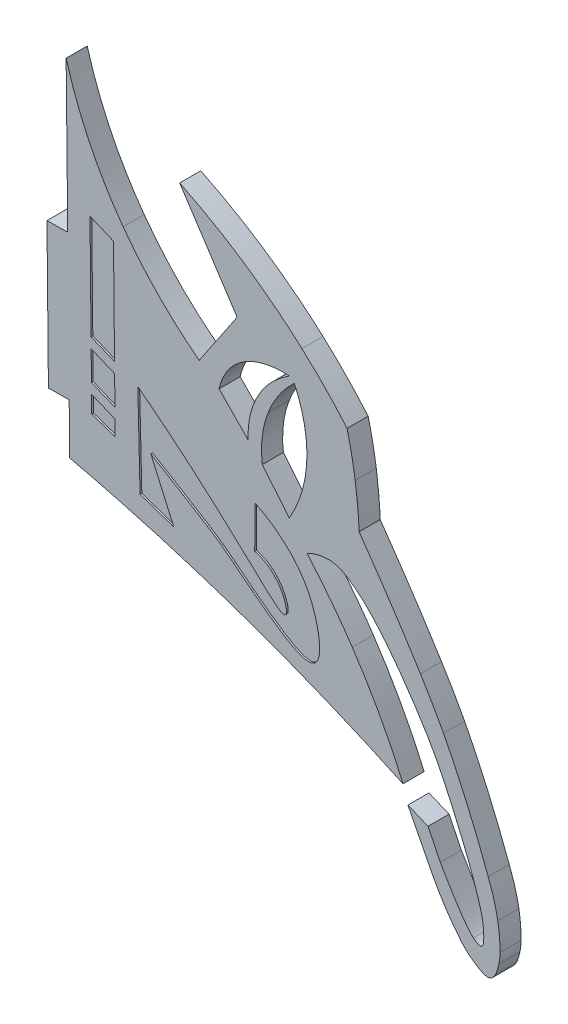
from build123d import *

# Parameters (mm, degrees)
BOSS_EXTRUDE1_DEPTH = 5.5
BOSS_EXTRUDE2_DEPTH = 6


with BuildPart() as part:
    # Model → Boss-Extrude1 (new body)
    with BuildSketch(Plane.XY):
        with BuildLine():
            add(Edge.make_bspline(
                [(109.834226, 17.744569), (106.735558, 23.743131), (104.335879, 28.467926), (102.940806, 31.225657)],
                knots=[0, 0, 0, 0, 1, 1, 1, 1], degree=3))
            ThreePointArc((109.834226, 17.744569), (113.743864145, 11.101212281), (118.360513621, 4.928206))
            add(Edge.make_bspline(
                [(121.463608, 2.155106), (119.789483664, 3.292442124), (118.727221514, 4.487161551), (118.360513621, 4.928206)],
                knots=[0, 0, 0, 0, 0.87061796, 0.87061796, 0.87061796, 0.87061796], degree=3))
            add(Edge.make_bspline(
                [(126.440333, 0.332713), (124.986288, -0.294061), (123.106948, 1.038656), (121.463608, 2.155106)],
                knots=[0, 0, 0, 0, 1, 1, 1, 1], degree=3))
            add(Edge.make_bspline(
                [(128.822962, 4.928206), (128.480309, 3.473676), (127.896944, 0.960588), (126.440333, 0.332713)],
                knots=[0, 0, 0, 0, 1, 1, 1, 1], degree=3))
            add(Edge.make_bspline(
                [(129.146717, 7.928679), (129.136257, 7.003388), (129.092662, 6.073042), (128.822962, 4.928206)],
                knots=[0, 0, 0, 0, 1, 1, 1, 1], degree=3))
            add(Edge.make_bspline(
                [(128.540698, 15.491307), (128.632815, 14.987485), (129.191051, 11.849306), (129.146717, 7.928679)],
                knots=[0, 0, 0, 0, 1, 1, 1, 1], degree=3))
            add(Edge.make_bspline(
                [(125.795153, 24.985524), (127.307626, 21.17734), (128.099604, 17.90388), (128.540698, 15.491307)],
                knots=[0, 0, 0, 0, 1, 1, 1, 1], degree=3))
            add(Edge.make_bspline(
                [(113.080832, 54.003331), (113.080842, 54.00332), (119.415646, 42.219052), (125.795153, 24.985524)],
                knots=[0, 0, 0, 0, 1, 1, 1, 1], degree=3))
            add(Edge.make_bspline(
                [(106.506681, 65.381827), (108.74943, 61.750912), (110.648644, 58.527792), (113.080832, 54.003331)],
                knots=[0, 0, 0, 0, 1, 1, 1, 1], degree=3))
            add(Edge.make_bspline(
                [(89.049511, 91.666149), (92.441385, 86.830647), (99.914814, 76.053776), (106.506681, 65.381827)],
                knots=[0, 0, 0, 0, 1, 1, 1, 1], degree=3))
            add(Edge.make_bspline(
                [(87.934382, 103.740468), (88.56126, 99.412169), (88.900341, 95.366482), (89.049511, 91.666149)],
                knots=[0, 0, 0, 0, 1, 1, 1, 1], degree=3))
            add(Edge.make_bspline(
                [(85.630465, 115.43659), (86.516891, 111.891294), (87.320202, 107.981033), (87.934382, 103.740468)],
                knots=[0, 0, 0, 0, 1, 1, 1, 1], degree=3))
            add(Edge.make_bspline(
                [(72.776561, 128.674577), (77.74838, 124.17885), (82.002138, 119.69877), (85.630465, 115.43659)],
                knots=[0, 0, 0, 0, 1, 1, 1, 1], degree=3))
            add(Edge.make_bspline(
                [(37.955949, 152.129016), (48.22445, 147.097548), (60.636254, 139.652346), (72.776561, 128.674577)],
                knots=[0, 0, 0, 0, 1, 1, 1, 1], degree=3))
            add(Edge.make_bspline(
                [(54.306234, 127.206907), (48.856132, 135.51427), (43.40605, 143.821643), (37.955949, 152.129016)],
                knots=[0, 0, 0, 0, 1, 1, 1, 1], degree=3))
            add(Edge.make_bspline(
                [(43.535337, 111.167568), (47.125643, 116.514022), (50.715938, 121.860464), (54.306234, 127.206907)],
                knots=[0, 0, 0, 0, 1, 1, 1, 1], degree=3))
            add(Edge.make_bspline(
                [(21.84655, 133.28925), (29.317084, 123.005187), (37.358531, 115.849009), (43.535337, 111.167568)],
                knots=[0, 0, 0, 0, 1, 1, 1, 1], degree=3))
            add(Edge.make_bspline(
                [(5.631043, 166.727797), (7.985977, 158.407028), (12.568325, 146.061817), (21.84655, 133.28925)],
                knots=[0, 0, 0, 0, 1, 1, 1, 1], degree=3))
            add(Edge.make_bspline(
                [(6.086836, 124.02331), (5.934905, 138.258142), (5.782974, 152.492975), (5.631043, 166.727797)],
                knots=[0, 0, 0, 0, 1, 1, 1, 1], degree=3))
            add(Edge.make_bspline(
                [(0.174546, 123.963816), (2.145306, 123.983644), (4.116076, 124.003471), (6.086836, 124.02331)],
                knots=[0, 0, 0, 0, 1, 1, 1, 1], degree=3))
            add(Edge.make_bspline(
                [(0.587514, 82.858837), (0.449851, 96.560497), (0.312199, 110.262156), (0.174546, 123.963816)],
                knots=[0, 0, 0, 0, 1, 1, 1, 1], degree=3))
            add(Edge.make_bspline(
                [(6.499803, 82.918331), (4.529044, 82.898503), (2.558273, 82.878675), (0.587514, 82.858837)],
                knots=[0, 0, 0, 0, 1, 1, 1, 1], degree=3))
            add(Edge.make_bspline(
                [(6.643101, 68.653983), (6.595339, 73.408765), (6.547566, 78.163558), (6.499803, 82.918331)],
                knots=[0, 0, 0, 0, 1, 1, 1, 1], degree=3))
            add(Edge.make_bspline(
                [(43.86637, 58.434006), (30.862075, 62.583906), (18.404931, 65.936719), (6.643101, 68.653983)],
                knots=[0, 0, 0, 0, 1, 1, 1, 1], degree=3))
            add(Edge.make_bspline(
                [(101.537039, 35.758871), (84.703851, 43.687605), (65.448453, 51.546798), (43.86637, 58.434006)],
                knots=[0, 0, 0, 0, 1, 1, 1, 1], degree=3))
            add(Edge.make_bspline(
                [(87.092619, 62.226102), (93.510034, 52.701742), (98.150707, 43.650158), (101.537039, 35.758871)],
                knots=[0, 0, 0, 0, 1, 1, 1, 1], degree=3))
            add(Edge.make_bspline(
                [(74.203763, 78.942905), (78.413844, 74.142713), (82.809801, 68.582397), (87.092619, 62.226102)],
                knots=[0, 0, 0, 0, 1, 1, 1, 1], degree=3))
            add(Edge.make_bspline(
                [(80.681352, 80.473016), (77.988024, 80.537965), (75.734261, 79.700235), (74.203763, 78.942905)],
                knots=[0, 0, 0, 0, 1, 1, 1, 1], degree=3))
            add(Edge.make_bspline(
                [(100.567344, 63.033114), (88.483165, 79.87623), (82.504235, 80.429056), (80.681352, 80.473016)],
                knots=[0, 0, 0, 0, 1, 1, 1, 1], degree=3))
            add(Edge.make_bspline(
                [(111.061858, 46.547876), (108.657087, 51.05441), (105.521312, 56.128226), (100.567344, 63.033114)],
                knots=[0, 0, 0, 0, 1, 1, 1, 1], degree=3))
            add(Edge.make_bspline(
                [(115.382881, 37.546231), (113.737694, 41.187666), (112.133689, 44.539246), (111.061858, 46.547876)],
                knots=[0, 0, 0, 0, 1, 1, 1, 1], degree=3))
            add(Edge.make_bspline(
                [(118.517066, 30.252738), (117.088868, 33.741057), (115.901577, 36.398159), (115.382881, 37.546231)],
                knots=[0, 0, 0, 0, 1, 1, 1, 1], degree=3))
            add(Edge.make_bspline(
                [(121.266624, 23.210636), (120.226573, 26.082845), (119.349211, 28.220222), (118.517066, 30.252738)],
                knots=[0, 0, 0, 0, 1, 1, 1, 1], degree=3))
            add(Edge.make_bspline(
                [(122.942997, 18.3066), (122.430778, 19.986653), (121.924697, 21.393288), (121.266624, 23.210636)],
                knots=[0, 0, 0, 0, 1, 1, 1, 1], degree=3))
            add(Edge.make_bspline(
                [(123.716211, 15.589696), (123.406396, 16.758982), (123.130732, 17.690828), (122.942997, 18.3066)],
                knots=[0, 0, 0, 0, 1, 1, 1, 1], degree=3))
            add(Edge.make_bspline(
                [(124.434211, 7.959253), (124.84532, 11.089284), (123.994318, 14.540075), (123.716211, 15.589696)],
                knots=[0, 0, 0, 0, 1, 1, 1, 1], degree=3))
            add(Edge.make_bspline(
                [(123.857302, 6.837779), (124.290081, 7.031999), (124.389363, 7.617762), (124.434211, 7.959253)],
                knots=[0, 0, 0, 0, 1, 1, 1, 1], degree=3))
            add(Edge.make_bspline(
                [(121.59505, 7.791641), (122.049344, 7.424528), (123.161721, 6.52565), (123.857302, 6.837779)],
                knots=[0, 0, 0, 0, 1, 1, 1, 1], degree=3))
            add(Edge.make_bspline(
                [(112.179912, 21.674617), (113.808142, 18.822545), (118.973495, 9.910064), (121.59505, 7.791641)],
                knots=[0, 0, 0, 0, 1, 1, 1, 1], degree=3))
            add(Edge.make_bspline(
                [(108.662661, 28.841695), (110.242307, 25.689904), (111.455599, 23.183524), (112.179912, 21.674617)],
                knots=[0, 0, 0, 0, 1, 1, 1, 1], degree=3))
            add(Edge.make_bspline(
                [(102.940806, 31.225657), (104.848088, 30.431003), (106.75538, 29.636359), (108.662661, 28.841695)],
                knots=[0, 0, 0, 0, 1, 1, 1, 1], degree=3))
        make_face()
        with BuildLine():
            add(Edge.make_bspline(
                [(61.016918, 112.130307), (57.373902, 106.353816), (57.3471, 100.778069), (57.476972, 98.475165)],
                knots=[0, 0, 0, 0, 1, 1, 1, 1], degree=3))
            add(Edge.make_bspline(
                [(57.476972, 98.475165), (54.709953, 101.310276), (51.942934, 104.145398), (49.175925, 106.980519)],
                knots=[0, 0, 0, 0, 1, 1, 1, 1], degree=3))
            add(Edge.make_bspline(
                [(49.175925, 106.980519), (49.545236, 108.715288), (50.528573, 111.976543), (53.435985, 114.906756)],
                knots=[0, 0, 0, 0, 1, 1, 1, 1], degree=3))
            add(Edge.make_bspline(
                [(53.435985, 114.906756), (59.350174, 120.867358), (68.036914, 120.228512), (69.185301, 120.126558)],
                knots=[0, 0, 0, 0, 1, 1, 1, 1], degree=3))
            add(Edge.make_bspline(
                [(69.185301, 120.126558), (67.160137, 118.878823), (63.695966, 116.378319), (61.016918, 112.130307)],
                knots=[0, 0, 0, 0, 1, 1, 1, 1], degree=3))
        make_face(mode=Mode.SUBTRACT)
        with BuildLine():
            add(Edge.make_bspline(
                [(70.5876, 119.036387), (68.598127, 117.174884), (65.256356, 113.560971), (63.144402, 108.102671)],
                knots=[0, 0, 0, 0, 1, 1, 1, 1], degree=3))
            add(Edge.make_bspline(
                [(73.687562, 97.349962), (75.416388, 107.362281), (72.296564, 115.406366), (70.5876, 119.036387)],
                knots=[0, 0, 0, 0, 1, 1, 1, 1], degree=3))
            add(Edge.make_bspline(
                [(69.139714, 85.095713), (70.814917, 87.931132), (72.778624, 92.085974), (73.687562, 97.349962)],
                knots=[0, 0, 0, 0, 1, 1, 1, 1], degree=3))
            add(Edge.make_bspline(
                [(61.492522, 94.466525), (64.041586, 91.342924), (66.59065, 88.219314), (69.139714, 85.095713)],
                knots=[0, 0, 0, 0, 1, 1, 1, 1], degree=3))
            add(Edge.make_bspline(
                [(63.144402, 108.102671), (60.867625, 102.21839), (61.148514, 97.10683), (61.492522, 94.466525)],
                knots=[0, 0, 0, 0, 1, 1, 1, 1], degree=3))
        make_face(mode=Mode.SUBTRACT)
    extrude(amount=BOSS_EXTRUDE1_DEPTH)

    # Model<3> → Boss-Extrude2 (add)
    with BuildSketch(Plane.XY):
        with BuildLine():
            add(Edge.make_bspline(
                [(109.834226, 17.744569), (106.735558, 23.743131), (104.335879, 28.467926), (102.940806, 31.225657)],
                knots=[0, 0, 0, 0, 1, 1, 1, 1], degree=3))
            ThreePointArc((109.834226, 17.744569), (113.743864145, 11.101212281), (118.360513621, 4.928206))
            add(Edge.make_bspline(
                [(121.463608, 2.155106), (119.789483664, 3.292442124), (118.727221514, 4.487161551), (118.360513621, 4.928206)],
                knots=[0, 0, 0, 0, 0.87061796, 0.87061796, 0.87061796, 0.87061796], degree=3))
            add(Edge.make_bspline(
                [(126.440333, 0.332713), (124.986288, -0.294061), (123.106948, 1.038656), (121.463608, 2.155106)],
                knots=[0, 0, 0, 0, 1, 1, 1, 1], degree=3))
            add(Edge.make_bspline(
                [(128.822962, 4.928206), (128.480309, 3.473676), (127.896944, 0.960588), (126.440333, 0.332713)],
                knots=[0, 0, 0, 0, 1, 1, 1, 1], degree=3))
            add(Edge.make_bspline(
                [(129.146717, 7.928679), (129.136257, 7.003388), (129.092662, 6.073042), (128.822962, 4.928206)],
                knots=[0, 0, 0, 0, 1, 1, 1, 1], degree=3))
            add(Edge.make_bspline(
                [(128.540698, 15.491307), (128.632815, 14.987485), (129.191051, 11.849306), (129.146717, 7.928679)],
                knots=[0, 0, 0, 0, 1, 1, 1, 1], degree=3))
            add(Edge.make_bspline(
                [(125.795153, 24.985524), (127.307626, 21.17734), (128.099604, 17.90388), (128.540698, 15.491307)],
                knots=[0, 0, 0, 0, 1, 1, 1, 1], degree=3))
            add(Edge.make_bspline(
                [(113.080832, 54.003331), (113.080842, 54.00332), (119.415646, 42.219052), (125.795153, 24.985524)],
                knots=[0, 0, 0, 0, 1, 1, 1, 1], degree=3))
            add(Edge.make_bspline(
                [(106.506681, 65.381827), (108.74943, 61.750912), (110.648644, 58.527792), (113.080832, 54.003331)],
                knots=[0, 0, 0, 0, 1, 1, 1, 1], degree=3))
            add(Edge.make_bspline(
                [(89.049511, 91.666149), (92.441385, 86.830647), (99.914814, 76.053776), (106.506681, 65.381827)],
                knots=[0, 0, 0, 0, 1, 1, 1, 1], degree=3))
            add(Edge.make_bspline(
                [(87.934382, 103.740468), (88.56126, 99.412169), (88.900341, 95.366482), (89.049511, 91.666149)],
                knots=[0, 0, 0, 0, 1, 1, 1, 1], degree=3))
            add(Edge.make_bspline(
                [(85.630465, 115.43659), (86.516891, 111.891294), (87.320202, 107.981033), (87.934382, 103.740468)],
                knots=[0, 0, 0, 0, 1, 1, 1, 1], degree=3))
            add(Edge.make_bspline(
                [(72.776561, 128.674577), (77.74838, 124.17885), (82.002138, 119.69877), (85.630465, 115.43659)],
                knots=[0, 0, 0, 0, 1, 1, 1, 1], degree=3))
            add(Edge.make_bspline(
                [(37.955949, 152.129016), (48.22445, 147.097548), (60.636254, 139.652346), (72.776561, 128.674577)],
                knots=[0, 0, 0, 0, 1, 1, 1, 1], degree=3))
            add(Edge.make_bspline(
                [(54.306234, 127.206907), (48.856132, 135.51427), (43.40605, 143.821643), (37.955949, 152.129016)],
                knots=[0, 0, 0, 0, 1, 1, 1, 1], degree=3))
            add(Edge.make_bspline(
                [(43.535337, 111.167568), (47.125643, 116.514022), (50.715938, 121.860464), (54.306234, 127.206907)],
                knots=[0, 0, 0, 0, 1, 1, 1, 1], degree=3))
            add(Edge.make_bspline(
                [(21.84655, 133.28925), (29.317084, 123.005187), (37.358531, 115.849009), (43.535337, 111.167568)],
                knots=[0, 0, 0, 0, 1, 1, 1, 1], degree=3))
            add(Edge.make_bspline(
                [(5.631043, 166.727797), (7.985977, 158.407028), (12.568325, 146.061817), (21.84655, 133.28925)],
                knots=[0, 0, 0, 0, 1, 1, 1, 1], degree=3))
            add(Edge.make_bspline(
                [(6.086836, 124.02331), (5.934905, 138.258142), (5.782974, 152.492975), (5.631043, 166.727797)],
                knots=[0, 0, 0, 0, 1, 1, 1, 1], degree=3))
            add(Edge.make_bspline(
                [(0.174546, 123.963816), (2.145306, 123.983644), (4.116076, 124.003471), (6.086836, 124.02331)],
                knots=[0, 0, 0, 0, 1, 1, 1, 1], degree=3))
            add(Edge.make_bspline(
                [(0.587514, 82.858837), (0.449851, 96.560497), (0.312199, 110.262156), (0.174546, 123.963816)],
                knots=[0, 0, 0, 0, 1, 1, 1, 1], degree=3))
            add(Edge.make_bspline(
                [(6.499803, 82.918331), (4.529044, 82.898503), (2.558273, 82.878675), (0.587514, 82.858837)],
                knots=[0, 0, 0, 0, 1, 1, 1, 1], degree=3))
            add(Edge.make_bspline(
                [(6.643101, 68.653983), (6.595339, 73.408765), (6.547566, 78.163558), (6.499803, 82.918331)],
                knots=[0, 0, 0, 0, 1, 1, 1, 1], degree=3))
            add(Edge.make_bspline(
                [(43.86637, 58.434006), (30.862075, 62.583906), (18.404931, 65.936719), (6.643101, 68.653983)],
                knots=[0, 0, 0, 0, 1, 1, 1, 1], degree=3))
            add(Edge.make_bspline(
                [(101.537039, 35.758871), (84.703851, 43.687605), (65.448453, 51.546798), (43.86637, 58.434006)],
                knots=[0, 0, 0, 0, 1, 1, 1, 1], degree=3))
            add(Edge.make_bspline(
                [(87.092619, 62.226102), (93.510034, 52.701742), (98.150707, 43.650158), (101.537039, 35.758871)],
                knots=[0, 0, 0, 0, 1, 1, 1, 1], degree=3))
            add(Edge.make_bspline(
                [(74.203763, 78.942905), (78.413844, 74.142713), (82.809801, 68.582397), (87.092619, 62.226102)],
                knots=[0, 0, 0, 0, 1, 1, 1, 1], degree=3))
            add(Edge.make_bspline(
                [(80.681352, 80.473016), (77.988024, 80.537965), (75.734261, 79.700235), (74.203763, 78.942905)],
                knots=[0, 0, 0, 0, 1, 1, 1, 1], degree=3))
            add(Edge.make_bspline(
                [(100.567344, 63.033114), (88.483165, 79.87623), (82.504235, 80.429056), (80.681352, 80.473016)],
                knots=[0, 0, 0, 0, 1, 1, 1, 1], degree=3))
            add(Edge.make_bspline(
                [(111.061858, 46.547876), (108.657087, 51.05441), (105.521312, 56.128226), (100.567344, 63.033114)],
                knots=[0, 0, 0, 0, 1, 1, 1, 1], degree=3))
            add(Edge.make_bspline(
                [(115.382881, 37.546231), (113.737694, 41.187666), (112.133689, 44.539246), (111.061858, 46.547876)],
                knots=[0, 0, 0, 0, 1, 1, 1, 1], degree=3))
            add(Edge.make_bspline(
                [(118.517066, 30.252738), (117.088868, 33.741057), (115.901577, 36.398159), (115.382881, 37.546231)],
                knots=[0, 0, 0, 0, 1, 1, 1, 1], degree=3))
            add(Edge.make_bspline(
                [(121.266624, 23.210636), (120.226573, 26.082845), (119.349211, 28.220222), (118.517066, 30.252738)],
                knots=[0, 0, 0, 0, 1, 1, 1, 1], degree=3))
            add(Edge.make_bspline(
                [(122.942997, 18.3066), (122.430778, 19.986653), (121.924697, 21.393288), (121.266624, 23.210636)],
                knots=[0, 0, 0, 0, 1, 1, 1, 1], degree=3))
            add(Edge.make_bspline(
                [(123.716211, 15.589696), (123.406396, 16.758982), (123.130732, 17.690828), (122.942997, 18.3066)],
                knots=[0, 0, 0, 0, 1, 1, 1, 1], degree=3))
            add(Edge.make_bspline(
                [(124.434211, 7.959253), (124.84532, 11.089284), (123.994318, 14.540075), (123.716211, 15.589696)],
                knots=[0, 0, 0, 0, 1, 1, 1, 1], degree=3))
            add(Edge.make_bspline(
                [(123.857302, 6.837779), (124.290081, 7.031999), (124.389363, 7.617762), (124.434211, 7.959253)],
                knots=[0, 0, 0, 0, 1, 1, 1, 1], degree=3))
            add(Edge.make_bspline(
                [(121.59505, 7.791641), (122.049344, 7.424528), (123.161721, 6.52565), (123.857302, 6.837779)],
                knots=[0, 0, 0, 0, 1, 1, 1, 1], degree=3))
            add(Edge.make_bspline(
                [(112.179912, 21.674617), (113.808142, 18.822545), (118.973495, 9.910064), (121.59505, 7.791641)],
                knots=[0, 0, 0, 0, 1, 1, 1, 1], degree=3))
            add(Edge.make_bspline(
                [(108.662661, 28.841695), (110.242307, 25.689904), (111.455599, 23.183524), (112.179912, 21.674617)],
                knots=[0, 0, 0, 0, 1, 1, 1, 1], degree=3))
            add(Edge.make_bspline(
                [(102.940806, 31.225657), (104.848088, 30.431003), (106.75538, 29.636359), (108.662661, 28.841695)],
                knots=[0, 0, 0, 0, 1, 1, 1, 1], degree=3))
        make_face()
        with BuildLine():
            add(Edge.make_bspline(
                [(63.995199, 69.640843), (62.346696, 71.0254), (60.594229, 71.668109), (59.331009, 71.986525)],
                knots=[0, 0, 0, 0, 1, 1, 1, 1], degree=3))
            add(Edge.make_bspline(
                [(59.331009, 71.986525), (59.337784, 75.9743), (59.344631, 79.962044), (59.351447, 83.949819)],
                knots=[0, 0, 0, 0, 1, 1, 1, 1], degree=3))
            add(Edge.make_bspline(
                [(59.351447, 83.949819), (63.01101, 82.167812), (71.584713, 77.333913), (75.547881, 67.505222)],
                knots=[0, 0, 0, 0, 1, 1, 1, 1], degree=3))
            add(Edge.make_bspline(
                [(75.547881, 67.505222), (77.370806, 62.984357), (79.242622, 54.866365), (76.257371, 52.875159)],
                knots=[0, 0, 0, 0, 1, 1, 1, 1], degree=3))
            add(Edge.make_bspline(
                [(76.257371, 52.875159), (73.219779, 50.849033), (65.881314, 56.391145), (58.447108, 61.984921)],
                knots=[0, 0, 0, 0, 1, 1, 1, 1], degree=3))
            add(Edge.make_bspline(
                [(58.447108, 61.984921), (56.471996, 63.471063), (55.461878, 64.357818), (53.399493, 65.993634)],
                knots=[0, 0, 0, 0, 1, 1, 1, 1], degree=3))
            add(Edge.make_bspline(
                [(53.399493, 65.993634), (51.889895, 67.190987), (50.6203, 68.156725), (49.934491, 68.673954)],
                knots=[0, 0, 0, 0, 1, 1, 1, 1], degree=3))
            add(Edge.make_bspline(
                [(49.934491, 68.673954), (49.93446, 68.673975), (49.670057, 68.873506), (49.411012, 69.067511)],
                knots=[0, 0, 0, 0, 1, 1, 1, 1], degree=3))
            add(Edge.make_bspline(
                [(49.411012, 69.067511), (47.926993, 70.178968), (40.287315, 74.907132), (29.753979, 81.21244)],
                knots=[0, 0, 0, 0, 1, 1, 1, 1], degree=3))
            add(Edge.make_bspline(
                [(29.753979, 81.21244), (31.928404, 76.292696), (34.10283, 71.372972), (36.277256, 66.453228)],
                knots=[0, 0, 0, 0, 1, 1, 1, 1], degree=3))
            add(Edge.make_bspline(
                [(36.277256, 66.453228), (33.078772, 67.546984), (29.880288, 68.64074), (26.681804, 69.734496)],
                knots=[0, 0, 0, 0, 1, 1, 1, 1], degree=3))
            add(Edge.make_bspline(
                [(26.681804, 69.734496), (26.468838, 78.489639), (26.255872, 87.244802), (26.042906, 95.999945)],
                knots=[0, 0, 0, 0, 1, 1, 1, 1], degree=3))
            add(Edge.make_bspline(
                [(26.042906, 95.999945), (31.726309, 91.615398), (39.764718, 85.158998), (49.016952, 76.808702)],
                knots=[0, 0, 0, 0, 1, 1, 1, 1], degree=3))
            add(Edge.make_bspline(
                [(49.016952, 76.808702), (61.106849, 65.897371), (66.567893, 59.60545), (68.022779, 60.673871)],
                knots=[0, 0, 0, 0, 1, 1, 1, 1], degree=3))
            add(Edge.make_bspline(
                [(68.022779, 60.673871), (69.110367, 61.472562), (67.555675, 66.650469), (63.995199, 69.640843)],
                knots=[0, 0, 0, 0, 1, 1, 1, 1], degree=3))
        make_face(mode=Mode.SUBTRACT)
        with BuildLine():
            add(Edge.make_bspline(
                [(19.552168, 84.683788), (17.323308, 85.612274), (15.094447, 86.54075), (12.865586, 87.469226)],
                knots=[0, 0, 0, 0, 1, 1, 1, 1], degree=3))
            add(Edge.make_bspline(
                [(19.595538, 80.366768), (19.581085, 81.805775), (19.566621, 83.244781), (19.552168, 84.683788)],
                knots=[0, 0, 0, 0, 1, 1, 1, 1], degree=3))
            add(Edge.make_bspline(
                [(12.914304, 82.620575), (15.141378, 81.869306), (17.368463, 81.118037), (19.595538, 80.366768)],
                knots=[0, 0, 0, 0, 1, 1, 1, 1], degree=3))
            add(Edge.make_bspline(
                [(12.865586, 87.469226), (12.881826, 85.853012), (12.898065, 84.236788), (12.914304, 82.620575)],
                knots=[0, 0, 0, 0, 1, 1, 1, 1], degree=3))
        make_face(mode=Mode.SUBTRACT)
        with BuildLine():
            add(Edge.make_bspline(
                [(19.440189, 95.830319), (17.211328, 96.758806), (14.982457, 97.687282), (12.753607, 98.615758)],
                knots=[0, 0, 0, 0, 1, 1, 1, 1], degree=3))
            add(Edge.make_bspline(
                [(19.522462, 87.64103), (19.495034, 90.370796), (19.467606, 93.100553), (19.440189, 95.830319)],
                knots=[0, 0, 0, 0, 1, 1, 1, 1], degree=3))
            add(Edge.make_bspline(
                [(12.836804, 90.334459), (15.065346, 89.436649), (17.293909, 88.538839), (19.522462, 87.64103)],
                knots=[0, 0, 0, 0, 1, 1, 1, 1], degree=3))
            add(Edge.make_bspline(
                [(12.753607, 98.615758), (12.781332, 95.855325), (12.809068, 93.094892), (12.836804, 90.334459)],
                knots=[0, 0, 0, 0, 1, 1, 1, 1], degree=3))
        make_face(mode=Mode.SUBTRACT)
        with BuildLine():
            add(Edge.make_bspline(
                [(19.113374, 128.359992), (16.884514, 129.288479), (14.655653, 130.216955), (12.426792, 131.145441)],
                knots=[0, 0, 0, 0, 1, 1, 1, 1], degree=3))
            add(Edge.make_bspline(
                [(19.410472, 98.787561), (19.311436, 108.645038), (19.21241, 118.502515), (19.113374, 128.359992)],
                knots=[0, 0, 0, 0, 1, 1, 1, 1], degree=3))
            add(Edge.make_bspline(
                [(12.72389, 101.573), (14.95275, 100.644524), (17.181611, 99.716048), (19.410472, 98.787561)],
                knots=[0, 0, 0, 0, 1, 1, 1, 1], degree=3))
            add(Edge.make_bspline(
                [(12.426792, 131.145441), (12.525828, 121.287954), (12.624854, 111.430487), (12.72389, 101.573)],
                knots=[0, 0, 0, 0, 1, 1, 1, 1], degree=3))
        make_face(mode=Mode.SUBTRACT)
        with BuildLine():
            add(Edge.make_bspline(
                [(61.016918, 112.130307), (57.373902, 106.353816), (57.3471, 100.778069), (57.476972, 98.475165)],
                knots=[0, 0, 0, 0, 1, 1, 1, 1], degree=3))
            add(Edge.make_bspline(
                [(57.476972, 98.475165), (54.709953, 101.310276), (51.942934, 104.145398), (49.175925, 106.980519)],
                knots=[0, 0, 0, 0, 1, 1, 1, 1], degree=3))
            add(Edge.make_bspline(
                [(49.175925, 106.980519), (49.545236, 108.715288), (50.528573, 111.976543), (53.435985, 114.906756)],
                knots=[0, 0, 0, 0, 1, 1, 1, 1], degree=3))
            add(Edge.make_bspline(
                [(53.435985, 114.906756), (59.350174, 120.867358), (68.036914, 120.228512), (69.185301, 120.126558)],
                knots=[0, 0, 0, 0, 1, 1, 1, 1], degree=3))
            add(Edge.make_bspline(
                [(69.185301, 120.126558), (67.160137, 118.878823), (63.695966, 116.378319), (61.016918, 112.130307)],
                knots=[0, 0, 0, 0, 1, 1, 1, 1], degree=3))
        make_face(mode=Mode.SUBTRACT)
        with BuildLine():
            add(Edge.make_bspline(
                [(70.5876, 119.036387), (68.598127, 117.174884), (65.256356, 113.560971), (63.144402, 108.102671)],
                knots=[0, 0, 0, 0, 1, 1, 1, 1], degree=3))
            add(Edge.make_bspline(
                [(73.687562, 97.349962), (75.416388, 107.362281), (72.296564, 115.406366), (70.5876, 119.036387)],
                knots=[0, 0, 0, 0, 1, 1, 1, 1], degree=3))
            add(Edge.make_bspline(
                [(69.139714, 85.095713), (70.814917, 87.931132), (72.778624, 92.085974), (73.687562, 97.349962)],
                knots=[0, 0, 0, 0, 1, 1, 1, 1], degree=3))
            add(Edge.make_bspline(
                [(61.492522, 94.466525), (64.041586, 91.342924), (66.59065, 88.219314), (69.139714, 85.095713)],
                knots=[0, 0, 0, 0, 1, 1, 1, 1], degree=3))
            add(Edge.make_bspline(
                [(63.144402, 108.102671), (60.867625, 102.21839), (61.148514, 97.10683), (61.492522, 94.466525)],
                knots=[0, 0, 0, 0, 1, 1, 1, 1], degree=3))
        make_face(mode=Mode.SUBTRACT)
    extrude(amount=BOSS_EXTRUDE2_DEPTH)


solid = part.part
